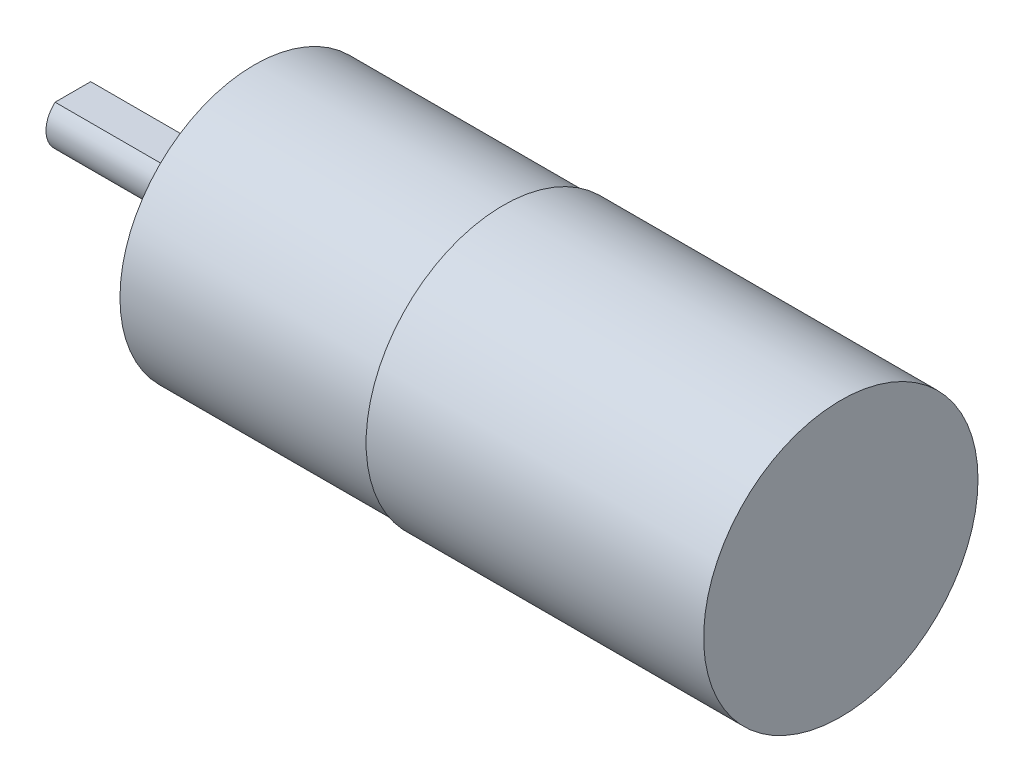
from build123d import *

# Parameters (mm, degrees)
SKETCH1_R           = 10.2
BOSS_EXTRUDE1_DEPTH = 25.1
SKETCH2_R           = 10
BOSS_EXTRUDE2_DEPTH = 18.5
SKETCH3_R           = 3.5
BOSS_EXTRUDE3_DEPTH = 3
SKETCH4_R           = 2
BOSS_EXTRUDE4_DEPTH = 10.5
CUT_EXTRUDE1_DEPTH  = 10.5
SKETCH6_R           = 1.25
CUT_EXTRUDE2_DEPTH  = 3


with BuildPart() as part:
    # Sketch1 → Boss-Extrude1 (new body)
    with BuildSketch(Plane(origin=(0, 0, 0), x_dir=(0, 0, -1), z_dir=(1, 0, 0))):
        Circle(SKETCH1_R)
    extrude(amount=BOSS_EXTRUDE1_DEPTH)

    # Sketch2 → Boss-Extrude2 (add)
    with BuildSketch(Plane.ZY):
        with Locations(Location((0, 0, 0), (0, 0, 180))):
            Circle(SKETCH2_R)
    extrude(amount=BOSS_EXTRUDE2_DEPTH)

    # Sketch3 → Boss-Extrude3 (add)
    with BuildSketch(Plane.ZY.offset(18.5)):
        Circle(SKETCH3_R)
    extrude(amount=BOSS_EXTRUDE3_DEPTH)

    # Sketch4 → Boss-Extrude4 (add)
    with BuildSketch(Plane.ZY.offset(21.5)):
        with Locations(Location((0, 0, 0), (0, 0, 180))):
            Circle(SKETCH4_R)
    extrude(amount=BOSS_EXTRUDE4_DEPTH)

    # Sketch5 → Cut-Extrude1 (cut)
    with BuildSketch(Plane.ZY.offset(32)):
        Polygon((-44.16593662, 1.5), (-1.322875656, 1.5), (1.322875656, 1.5), (44.16593662, 1.5), (44.16593662, 87.186121928), (-44.16593662, 87.186121928), align=None)
    extrude(amount=-CUT_EXTRUDE1_DEPTH, mode=Mode.SUBTRACT)

    # Sketch6 → Cut-Extrude2 (cut)
    with BuildSketch(Plane.ZY.offset(18.5)):
        with Locations((0, 7.5)):
            Circle(SKETCH6_R)
        with Locations((0, -7.5)):
            Circle(SKETCH6_R)
    extrude(amount=-CUT_EXTRUDE2_DEPTH, mode=Mode.SUBTRACT)


solid = part.part
